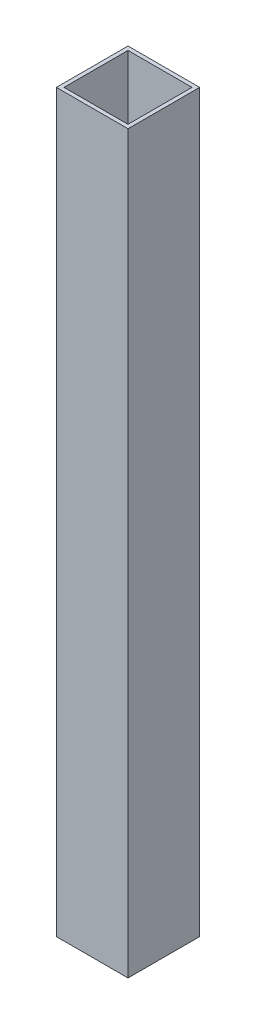
from build123d import *

# Parameters (mm, degrees)
ESQUISSE1_W        = 15
ESQUISSE1_H        = 15
ESQUISSE1_W_2      = 13.4
ESQUISSE1_H_2      = 13.4
BOSS_EXTRU_1_DEPTH = 154


with BuildPart() as part:
    # Esquisse1 → Boss.-Extru.1 (new body)
    with BuildSketch(Plane(origin=(0, 0, 0), x_dir=(1, 0, 0), z_dir=(0, 1, 0))):
        Rectangle(ESQUISSE1_W, ESQUISSE1_H)
        Rectangle(ESQUISSE1_W_2, ESQUISSE1_H_2, mode=Mode.SUBTRACT)
    extrude(amount=BOSS_EXTRU_1_DEPTH)


solid = part.part
